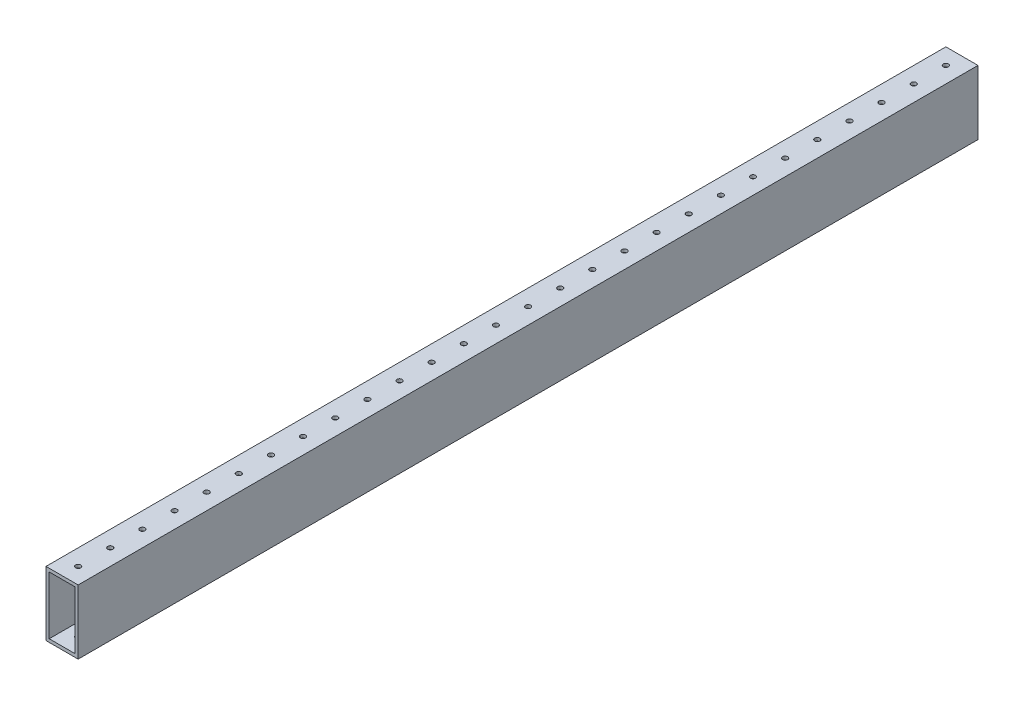
from build123d import *

# Parameters (mm, degrees)
SKETCH1_W           = 25.4
SKETCH1_H           = 50.8
SKETCH1_W_2         = 20.32
SKETCH1_H_2         = 45.72
BOSS_EXTRUDE1_DEPTH = 711.2
SKETCH2_R           = 2.032
CUT_EXTRUDE1_DEPTH  = 714.125073181


with BuildPart() as part:
    # Sketch1 → Boss-Extrude1 (new body)
    with BuildSketch(Plane.XY):
        Rectangle(SKETCH1_W, SKETCH1_H)
        Rectangle(SKETCH1_W_2, SKETCH1_H_2, mode=Mode.SUBTRACT)
    extrude(amount=-BOSS_EXTRUDE1_DEPTH)

    # Sketch2 → Cut-Extrude1 (cut, through all)
    with BuildSketch(Plane(origin=(0, 25.4, 0), x_dir=(1, 0, 0), z_dir=(0, 1, 0))):
        with Locations(Location((0, 12.7, 0), (0, 0, 270))):
            Circle(SKETCH2_R)
        with Locations(Location((0, 38.1, 0), (0, 0, 270))):
            Circle(SKETCH2_R)
        with Locations(Location((0, 63.5, 0), (0, 0, 270))):
            Circle(SKETCH2_R)
        with Locations(Location((0, 88.9, 0), (0, 0, 270))):
            Circle(SKETCH2_R)
        with Locations(Location((0, 114.3, 0), (0, 0, 270))):
            Circle(SKETCH2_R)
        with Locations(Location((0, 139.7, 0), (0, 0, 270))):
            Circle(SKETCH2_R)
        with Locations(Location((0, 165.1, 0), (0, 0, 270))):
            Circle(SKETCH2_R)
        with Locations(Location((0, 190.5, 0), (0, 0, 270))):
            Circle(SKETCH2_R)
        with Locations(Location((0, 215.9, 0), (0, 0, 270))):
            Circle(SKETCH2_R)
        with Locations(Location((0, 241.3, 0), (0, 0, 270))):
            Circle(SKETCH2_R)
        with Locations(Location((0, 266.7, 0), (0, 0, 270))):
            Circle(SKETCH2_R)
        with Locations(Location((0, 292.1, 0), (0, 0, 270))):
            Circle(SKETCH2_R)
        with Locations(Location((0, 317.5, 0), (0, 0, 270))):
            Circle(SKETCH2_R)
        with Locations(Location((0, 342.9, 0), (0, 0, 270))):
            Circle(SKETCH2_R)
        with Locations(Location((0, 368.3, 0), (0, 0, 270))):
            Circle(SKETCH2_R)
        with Locations(Location((0, 393.7, 0), (0, 0, 270))):
            Circle(SKETCH2_R)
        with Locations(Location((0, 419.1, 0), (0, 0, 270))):
            Circle(SKETCH2_R)
        with Locations(Location((0, 444.5, 0), (0, 0, 270))):
            Circle(SKETCH2_R)
        with Locations(Location((0, 469.9, 0), (0, 0, 270))):
            Circle(SKETCH2_R)
        with Locations(Location((0, 495.3, 0), (0, 0, 270))):
            Circle(SKETCH2_R)
        with Locations(Location((0, 520.7, 0), (0, 0, 270))):
            Circle(SKETCH2_R)
        with Locations(Location((0, 546.1, 0), (0, 0, 270))):
            Circle(SKETCH2_R)
        with Locations(Location((0, 571.5, 0), (0, 0, 270))):
            Circle(SKETCH2_R)
        with Locations(Location((0, 596.9, 0), (0, 0, 270))):
            Circle(SKETCH2_R)
        with Locations(Location((0, 622.3, 0), (0, 0, 270))):
            Circle(SKETCH2_R)
        with Locations(Location((0, 647.7, 0), (0, 0, 270))):
            Circle(SKETCH2_R)
        with Locations(Location((0, 673.1, 0), (0, 0, 270))):
            Circle(SKETCH2_R)
        with Locations(Location((0, 698.5, 0), (0, 0, 270))):
            Circle(SKETCH2_R)
        with Locations((0, 723.9)):
            Circle(SKETCH2_R)
        with Locations((0, 749.3)):
            Circle(SKETCH2_R)
    extrude(amount=-CUT_EXTRUDE1_DEPTH, mode=Mode.SUBTRACT)


solid = part.part
